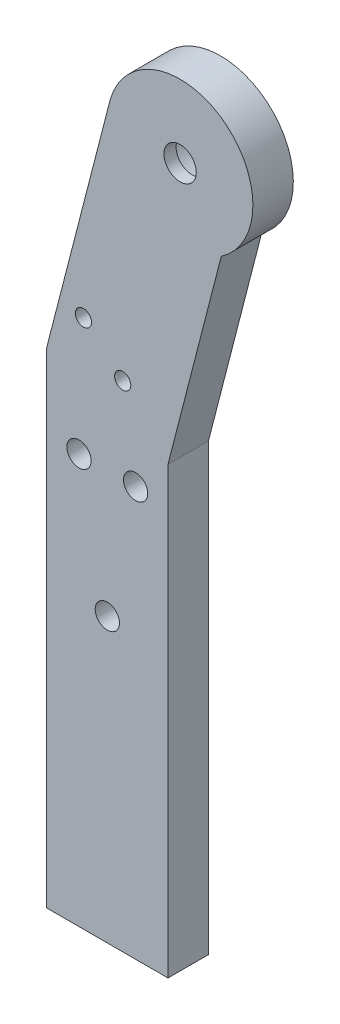
from build123d import *

# Parameters (mm, degrees)
SKETCH1_R           = 2
SKETCH1_R_2         = 1.5
BOSS_EXTRUDE1_DEPTH = 5
SKETCH3_R           = 4.5
CUT_EXTRUDE1_DEPTH  = 3.5
SKETCH7_R           = 1
CUT_EXTRUDE3_DEPTH  = 10
SKETCH10_R          = 1.499999992
CUT_EXTRUDE4_DEPTH  = 108.72827842


with BuildPart() as part:
    # Sketch1 → Boss-Extrude1 (new body)
    with BuildSketch(Plane.XY):
        with BuildLine():
            Line((8.662544735, 63.892298354), (8.662544735, 8.892298354))
            Line((8.662544735, 8.892298354), (-6.337455265, 8.892298354))
            Line((-6.337455265, 8.892298354), (-6.337455265, 68.892298354))
            Line((-6.337455265, 68.892298354), (1.556032109, 99.524396458))
            ThreePointArc((1.556032109, 99.524396458), (15.487791899, 104.147761306), (15.253774048, 89.470749723))
            Line((15.253774048, 89.470749723), (8.662544735, 63.892298354))
        make_face()
        with Locations((10.162544735, 96.892298354)):
            Circle(SKETCH1_R, mode=Mode.SUBTRACT)
        with Locations((1.162544735, 43.892298354)):
            Circle(SKETCH1_R_2, mode=Mode.SUBTRACT)
    extrude(amount=BOSS_EXTRUDE1_DEPTH)

    # Sketch3 → Cut-Extrude1 (cut)
    with BuildSketch(Plane(origin=(0, 0, 0), x_dir=(-1, 0, 0), z_dir=(0, 0, -1))):
        with Locations((-10.162544735, 96.892298354)):
            Circle(SKETCH3_R)
    extrude(amount=-CUT_EXTRUDE1_DEPTH, mode=Mode.SUBTRACT)

    # Sketch7 → Cut-Extrude3 (cut)
    with BuildSketch(Plane(origin=(0, 0, 0), x_dir=(-1, 0, 0), z_dir=(0, 0, -1))):
        with Locations((-3.063597883, 70.045794856)):
            Circle(SKETCH7_R)
        with Locations((1.794946815, 74.363727627)):
            Circle(SKETCH7_R)
    extrude(amount=-CUT_EXTRUDE3_DEPTH, mode=Mode.SUBTRACT)

    # Sketch10 → Cut-Extrude4 (cut, through all)
    with BuildSketch(Plane(origin=(0, 0, 0), x_dir=(-1, 0, 0), z_dir=(0, 0, -1))):
        with Locations((2.337455106, 59.512300154)):
            Circle(SKETCH10_R)
        with Locations((-4.662544922, 59.512300154)):
            Circle(SKETCH10_R)
    extrude(amount=-CUT_EXTRUDE4_DEPTH, mode=Mode.SUBTRACT)


solid = part.part
